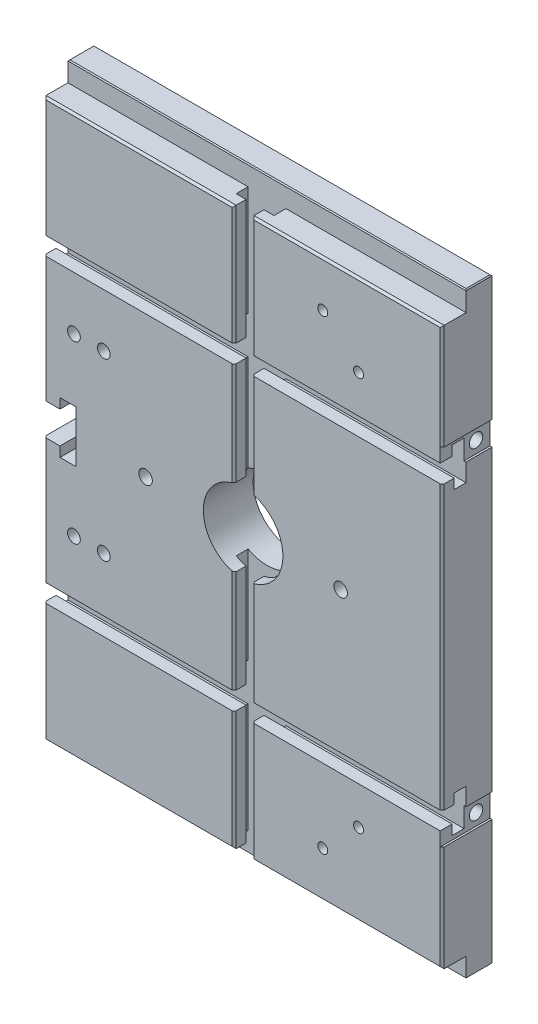
from build123d import *

# Parameters (mm, degrees)
SKETCH_1_W                   = 200
SKETCH_1_H                   = 300
EXTRUDE_1_DEPTH              = 25
SKETCH_2_W                   = 12
SKETCH_2_H                   = 10
CUT_EXTRUDE_1_DEPTH          = 540.096466321
CUT_EXTRUDE_2_DEPTH          = 426.23522902
CHAMFER_2_SIZE               = 0.5
CHAMFER_3_SIZE               = 1
SKETCH_4_R                   = 20
CUT_EXTRUDE_3_DEPTH          = 589.833592792
CUT_EXTRUDE_4_DEPTH          = 540.096466321
M8X1_25_1_D                  = 6.8
HOLE_WIZARD_M6_1_D           = 6.4
HOLE_WIZARD_M6_1_CBORE_D     = 11
HOLE_WIZARD_M6_1_CBORE_DEPTH = 6
SKETCH_12_W                  = 1
SKETCH_12_H                  = 12
CUT_EXTRUDE_5_DEPTH          = 589.833592792
M8X1_25_2_D                  = 6.8
M8X1_25_2_DEPTH              = 22.25
M8X1_25_2_TIP                = 2.042926105
M6X1_0_1_D                   = 5
M6X1_0_1_DEPTH               = 17
M6X1_0_1_TIP                 = 1.502151548
M6X1_0_2_D                   = 5
CUT_EXTRUDE_6_DEPTH          = 589.833592792


with BuildPart() as part:
    # 草图1 → 凸台-拉伸1 (new body)
    with BuildSketch(Plane.XY):
        with Locations((210, 350)):
            Rectangle(SKETCH_1_W, SKETCH_1_H)
    extrude(amount=EXTRUDE_1_DEPTH)

    # 草图2 → 切除-拉伸1 (cut, through all)
    with BuildSketch(Plane.ZY.offset(-110)):
        with Locations((19, 495)):
            Rectangle(SKETCH_2_W, SKETCH_2_H)
        with Locations((19, 205)):
            Rectangle(SKETCH_2_W, SKETCH_2_H)
    extrude(amount=-CUT_EXTRUDE_1_DEPTH, mode=Mode.SUBTRACT)

    # 草图3 → 切除-拉伸2 (cut, through all)
    with BuildSketch(Plane(origin=(0, 490, 0), x_dir=(1, 0, 0), z_dir=(0, 1, 0))):
        Polygon((205.5, -25), (214.5, -25), (214.5, -19), (219.5, -19), (219.5, -13), (200.5, -13), (200.5, -19), (205.5, -19), align=None)
    extrude(amount=-CUT_EXTRUDE_2_DEPTH, mode=Mode.SUBTRACT)

    # 倒角2
    chamfer_2_edges = [part.edges().sort_by_distance(p)[0] for p in [
        (110, 500, 6.5),
        (310, 500, 6.5),
        (210, 500, 13),
        (310, 200, 6.5),
        (110, 200, 6.5),
        (210, 200, 13),
        (210, 500, 0),
        (210, 200, 0),
    ]]
    chamfer(chamfer_2_edges, length=CHAMFER_2_SIZE)

    # 倒角3
    chamfer_3_edges = [part.edges().sort_by_distance(p)[0] for p in [
        (110, 350, 25),
        (262.25, 490, 25),
        (310, 350, 25),
        (262.25, 210, 25),
        (157.75, 210, 25),
        (157.75, 490, 25),
        (205.5, 350, 25),
        (214.5, 350, 25),
    ]]
    chamfer(chamfer_3_edges, length=CHAMFER_3_SIZE)

    # 草图4 → 切除-拉伸3 (cut, through all)
    with BuildSketch(Plane.XY.offset(25)):
        with Locations((210, 350)):
            Circle(SKETCH_4_R)
    extrude(amount=-CUT_EXTRUDE_3_DEPTH, mode=Mode.SUBTRACT)

    # 草图5 → 切除-拉伸4 (cut, through all)
    with BuildSketch(Plane.ZY.offset(-110)):
        Polygon((25, 421), (25, 430), (19, 430), (19, 435), (13, 435), (13, 416), (19, 416), (19, 421), align=None)
        Polygon((13, 265), (19, 265), (19, 270), (25, 270), (25, 279), (19, 279), (19, 284), (13, 284), align=None)
    extrude(amount=-CUT_EXTRUDE_4_DEPTH, mode=Mode.SUBTRACT)

    # M8x1.25 螺纹孔1 (through all)
    with Locations(Plane.XY.offset(25)):
        with Locations((161, 350), (210, 399), (259, 350), (210, 301)):
            Hole(M8X1_25_1_D / 2)

    # M6 凹头盖螺钉的柱形沉头孔1 (through all)
    with Locations(Plane(origin=(0, 0, 0), x_dir=(-1, 0, 0), z_dir=(0, 0, -1))):
        with Locations((-125, 394.25), (-140, 394.25), (-140, 306.25), (-125, 306.25)):
            CounterBoreHole(HOLE_WIZARD_M6_1_D / 2, HOLE_WIZARD_M6_1_CBORE_D / 2, HOLE_WIZARD_M6_1_CBORE_DEPTH)

    # 草图12 → 切除-拉伸5 (cut, through all)
    with BuildSketch(Plane.XY.offset(25)):
        with Locations((309.5, 431)):
            Rectangle(SKETCH_12_W, SKETCH_12_H)
        with Locations((309.5, 269)):
            Rectangle(SKETCH_12_W, SKETCH_12_H)
    extrude(amount=-CUT_EXTRUDE_5_DEPTH, mode=Mode.SUBTRACT)

    # M8x1.25 螺纹孔2
    with Locations(Plane(origin=(309, 0, 0), x_dir=(0, 0, -1), z_dir=(1, 0, 0))):
        with Locations((-7, 431), (-7, 269)):
            Hole(M8X1_25_2_D / 2, depth=M8X1_25_2_DEPTH)
            with Locations((0, 0, -(M8X1_25_2_DEPTH + M8X1_25_2_TIP / 2))):  # 118° drill point
                Cone(0, M8X1_25_2_D / 2, M8X1_25_2_TIP, mode=Mode.SUBTRACT)

    # M6x1.0 螺纹孔1
    with Locations(Plane.ZY.offset(-110)):
        with Locations((7, 380), (7, 320)):
            Hole(M6X1_0_1_D / 2, depth=M6X1_0_1_DEPTH)
            with Locations((0, 0, -(M6X1_0_1_DEPTH + M6X1_0_1_TIP / 2))):  # 118° drill point
                Cone(0, M6X1_0_1_D / 2, M6X1_0_1_TIP, mode=Mode.SUBTRACT)

    # M6x1.0 螺纹孔2 (through all)
    with Locations(Plane.XY.offset(25)):
        with Locations((250, 467), (268, 449), (250, 233), (268, 251)):
            Hole(M6X1_0_2_D / 2)

    # 草图19 → 切除-拉伸6 (cut, through all)
    with BuildSketch(Plane.XY.offset(25)):
        Polygon((110, 358), (118, 358), (118, 363), (126, 363), (126, 337), (118, 337), (118, 342), (110, 342), align=None)
    extrude(amount=-CUT_EXTRUDE_6_DEPTH, mode=Mode.SUBTRACT)


solid = part.part
